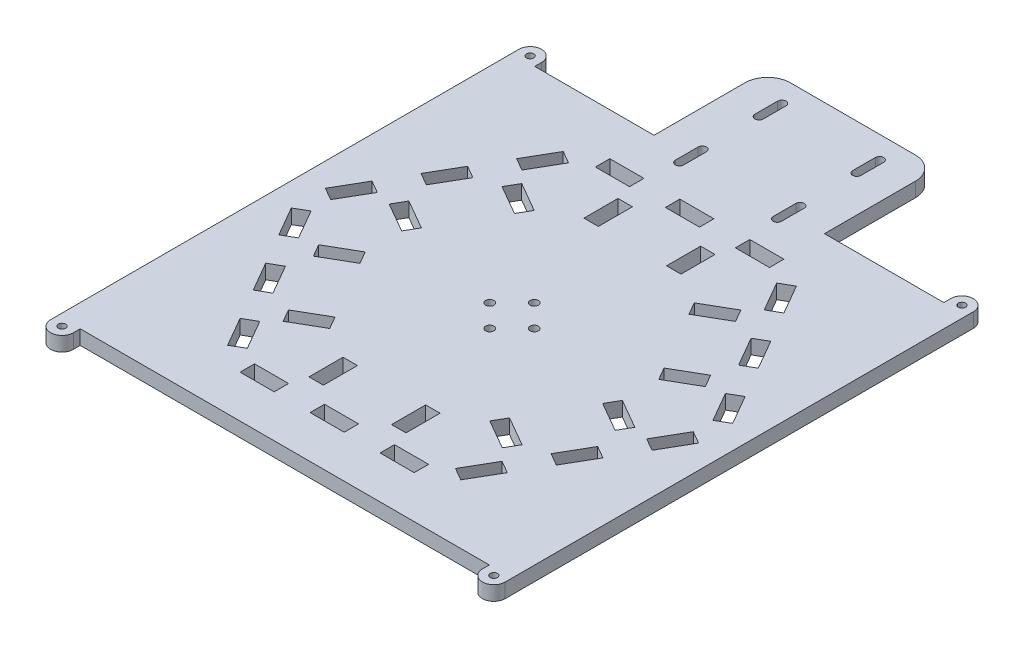
from build123d import *

# Parameters (mm, degrees)
ESQUISSE1_W                     = 200
ESQUISSE1_H                     = 200
BOSS_EXTRU_1_DEPTH              = 6.35
BOSS_EXTRU_2_DEPTH              = 6.35
ENL_V_MAT_EXTRU_1_REACH         = 149.324
ESQUISSE3_R                     = 1.5875
R_P_TITION_LIN_AIRE1_COUNT      = 2
R_P_TITION_LIN_AIRE1_PITCH      = 190
SYM_TRIE1_COPY_1_DEPTH          = 6.35
SYM_TRIE1_COPY_2_REACH          = 149.324
SYM_TRIE1_COPY_2_SKETCH_R       = 1.5875
ESQUISSE4_W                     = 75
ESQUISSE4_H                     = 50
BOSS_EXTRU_3_DEPTH              = 6.35
CONG_1_R                        = 10
SKETCH1_R                       = 1.8288
CUT_EXTRUDE1_DEPTH              = 6.35
CIRPATTERN1_COUNT               = 4
ESQUISSE7_W                     = 15
ESQUISSE7_H                     = 6.35
ENL_V_MAT_EXTRU_2_DEPTH         = 6.35
R_P_TITION_CIRCULAIRE1_COUNT    = 6
ENL_V_MAT_EXTRU_3_REACH         = 182.389
R_P_TITION_LIN_AIRE2_COUNT      = 2
R_P_TITION_LIN_AIRE2_PITCH      = 35
R_P_TITION_LIN_AIRE2_COUNT_DIR2 = 2
R_P_TITION_LIN_AIRE2_PITCH_DIR2 = 43
ENL_V_MAT_EXTRU_4_REACH         = 182.389
ESQUISSE9_W                     = 6.35
ESQUISSE9_H                     = 15
R_P_TITION_CIRCULAIRE2_COUNT    = 6


with BuildPart() as part:
    # Esquisse1 → Boss.-Extru.1 (new body)
    with BuildSketch(Plane(origin=(0, 0, 0), x_dir=(1, 0, 0), z_dir=(0, 1, 0))):
        Rectangle(ESQUISSE1_W, ESQUISSE1_H)
    extrude(amount=BOSS_EXTRU_1_DEPTH)

    # Esquisse2 → Boss.-Extru.2 (add)
    with BuildSketch(Plane(origin=(0, 6.35, 0), x_dir=(1, 0, 0), z_dir=(0, 1, 0))):
        with BuildLine():
            Line((-100, 100), (-90, 100))
            Line((-90, 100), (-90, 103))
            ThreePointArc((-90, 103), (-95, 108), (-100, 103))
            Line((-100, 103), (-100, 100))
        make_face()
    boss_extru_2 = extrude(amount=-BOSS_EXTRU_2_DEPTH)

    # Esquisse3 → Enlèv. mat.-Extru.1 (cut, up to next)
    with BuildSketch(Plane(origin=(0, 6.35, 0), x_dir=(1, 0, 0), z_dir=(0, 1, 0)), mode=Mode.PRIVATE) as enl_v_mat_extru_1_sk1:
        with Locations(Location((-95, 103, 0), (0, 0, 270))):
            Circle(ESQUISSE3_R)
    enl_v_mat_extru_1_tool1 = extrude(enl_v_mat_extru_1_sk1.sketch, amount=-ENL_V_MAT_EXTRU_1_REACH, mode=Mode.PRIVATE) & part.part
    enl_v_mat_extru_1 = enl_v_mat_extru_1_tool1.solids().sort_by_distance((-95, 6.35, -103))[0]
    add(enl_v_mat_extru_1, mode=Mode.SUBTRACT)

    # Répétition linéaire1: Boss.-Extru.2, Enlèv. mat.-Extru.1 ×2
    with Locations(*[(i * R_P_TITION_LIN_AIRE1_PITCH, 0, 0) for i in range(1, R_P_TITION_LIN_AIRE1_COUNT)]):
        add(boss_extru_2)
        add(enl_v_mat_extru_1, mode=Mode.SUBTRACT)

    # Symétrie1: Boss.-Extru.2, Enlèv. mat.-Extru.1 across plane
    add(boss_extru_2.mirror(Plane.XY))
    add(enl_v_mat_extru_1.mirror(Plane.XY), mode=Mode.SUBTRACT)

    # Symétrie1 copy 1 sketch → Symétrie1 copy 1 (add)
    with BuildSketch(Plane(origin=(190, 6.35, 0), x_dir=(1, 0, 0), z_dir=(0, 1, 0))):
        with BuildLine():
            Line((-100, -100), (-90, -100))
            Line((-90, -100), (-90, -103))
            ThreePointArc((-90, -103), (-95, -108), (-100, -103))
            Line((-100, -103), (-100, -100))
        make_face()
    extrude(amount=-SYM_TRIE1_COPY_1_DEPTH)

    # Symétrie1 copy 2 sketch → Symétrie1 copy 2 (cut, up to next)
    with BuildSketch(Plane(origin=(190, 6.35, 0), x_dir=(1, 0, 0), z_dir=(0, 1, 0)), mode=Mode.PRIVATE) as sym_trie1_copy_2_sk1:
        with Locations((-95, -103)):
            Circle(SYM_TRIE1_COPY_2_SKETCH_R)
    sym_trie1_copy_2_tool1 = extrude(sym_trie1_copy_2_sk1.sketch, amount=-SYM_TRIE1_COPY_2_REACH, mode=Mode.PRIVATE) & part.part
    add(sym_trie1_copy_2_tool1.solids().sort_by_distance((95, 6.35, 103))[0], mode=Mode.SUBTRACT)

    # Esquisse4 → Boss.-Extru.3 (add)
    with BuildSketch(Plane(origin=(0, 6.35, 0), x_dir=(1, 0, 0), z_dir=(0, 1, 0))):
        with Locations((0, 125)):
            Rectangle(ESQUISSE4_W, ESQUISSE4_H)
    extrude(amount=-BOSS_EXTRU_3_DEPTH)

    # Congé1
    cong_1_edges = [part.edges().sort_by_distance(p)[0] for p in [
        (-37.5, 3.175, -150),
        (37.5, 3.175, -150),
    ]]
    fillet(cong_1_edges, radius=CONG_1_R)

    # Sketch1 → Cut-Extrude1 (cut)
    with BuildSketch(Plane.XZ):
        with Locations(Location((0, -9.779, 0), (0, 0, 270))):
            Circle(SKETCH1_R)
    cut_extrude1 = extrude(amount=-CUT_EXTRUDE1_DEPTH, mode=Mode.SUBTRACT)

    # CirPattern1: Cut-Extrude1 ×4 about axis
    cirpattern1_axis = Axis((0, 0, 0), (0, 1, 0))
    for i in range(1, CIRPATTERN1_COUNT):
        add(cut_extrude1.rotate(cirpattern1_axis, i * 360 / CIRPATTERN1_COUNT), mode=Mode.SUBTRACT)

    # Esquisse7 → Enlèv. mat.-Extru.2 (cut)
    with BuildSketch(Plane.XZ):
        with Locations((30.801270189, -78.175)):
            Rectangle(ESQUISSE7_W, ESQUISSE7_H)
        with Locations((0, -78.175)):
            Rectangle(ESQUISSE7_W, ESQUISSE7_H)
        with Locations((-30.801270189, -78.175)):
            Rectangle(ESQUISSE7_W, ESQUISSE7_H)
    enl_v_mat_extru_2 = extrude(amount=-ENL_V_MAT_EXTRU_2_DEPTH, mode=Mode.SUBTRACT)

    # Répétition circulaire1: Enlèv. mat.-Extru.2 ×6 about axis
    r_p_tition_circulaire1_axis = Axis((0, 0, 0), (0, 1, 0))
    for i in range(1, R_P_TITION_CIRCULAIRE1_COUNT):
        add(enl_v_mat_extru_2.rotate(r_p_tition_circulaire1_axis, i * 360 / R_P_TITION_CIRCULAIRE1_COUNT), mode=Mode.SUBTRACT)

    # Esquisse8 → Enlèv. mat.-Extru.3 (cut, up to next)
    with BuildSketch(Plane(origin=(0, 6.35, 0), x_dir=(1, 0, 0), z_dir=(0, 1, 0)), mode=Mode.PRIVATE) as enl_v_mat_extru_3_sk1:
        with BuildLine():
            Line((-19.666666667, 140.227252842), (-19.666666667, 130.227252842))
            ThreePointArc((-19.666666667, 130.227252842), (-21.5, 128.393919509), (-23.333333333, 130.227252842))
            Line((-23.333333333, 130.227252842), (-23.333333333, 140.227252842))
            ThreePointArc((-23.333333333, 140.227252842), (-21.5, 142.060586175), (-19.666666667, 140.227252842))
        make_face()
    enl_v_mat_extru_3_tool1 = extrude(enl_v_mat_extru_3_sk1.sketch, amount=-ENL_V_MAT_EXTRU_3_REACH, mode=Mode.PRIVATE) & part.part
    enl_v_mat_extru_3 = enl_v_mat_extru_3_tool1.solids().sort_by_distance((-21.5, 6.35, -135.227253))[0]
    add(enl_v_mat_extru_3, mode=Mode.SUBTRACT)

    # Répétition linéaire2: Enl_v. mat.-Extru.3 2 × 2
    with Locations(*[(j * R_P_TITION_LIN_AIRE2_PITCH_DIR2, 0, i * R_P_TITION_LIN_AIRE2_PITCH) for i in range(R_P_TITION_LIN_AIRE2_COUNT) for j in range(R_P_TITION_LIN_AIRE2_COUNT_DIR2) if (i, j) != (0, 0)]):
        add(enl_v_mat_extru_3, mode=Mode.SUBTRACT)

    # Esquisse9 → Enlèv. mat.-Extru.4 (cut, up to next)
    with BuildSketch(Plane.XZ, mode=Mode.PRIVATE) as enl_v_mat_extru_4_sk1:
        with Locations((-18.175, -60.5)):
            Rectangle(ESQUISSE9_W, ESQUISSE9_H)
    enl_v_mat_extru_4_tool1 = extrude(enl_v_mat_extru_4_sk1.sketch, amount=-ENL_V_MAT_EXTRU_4_REACH, mode=Mode.PRIVATE) & part.part
    # Esquisse9 → Enlèv. mat.-Extru.4 (cut, up to next)
    with BuildSketch(Plane.XZ, mode=Mode.PRIVATE) as enl_v_mat_extru_4_sk2:
        with Locations((18.175, -60.5)):
            Rectangle(ESQUISSE9_W, ESQUISSE9_H)
    enl_v_mat_extru_4_tool2 = extrude(enl_v_mat_extru_4_sk2.sketch, amount=-ENL_V_MAT_EXTRU_4_REACH, mode=Mode.PRIVATE) & part.part
    enl_v_mat_extru_4_1 = enl_v_mat_extru_4_tool1.solids().sort_by_distance((-18.175, 0, -60.5))[0]
    add(enl_v_mat_extru_4_1, mode=Mode.SUBTRACT)
    enl_v_mat_extru_4_2 = enl_v_mat_extru_4_tool2.solids().sort_by_distance((18.175, 0, -60.5))[0]
    add(enl_v_mat_extru_4_2, mode=Mode.SUBTRACT)
    enl_v_mat_extru_4 = enl_v_mat_extru_4_1 + enl_v_mat_extru_4_2  # Enlèv. mat.-Extru.4 as one shape, for the pattern or mirror that repeats it

    # Répétition circulaire2: Enlèv. mat.-Extru.4 ×6 about axis
    r_p_tition_circulaire2_axis = Axis((0, 0, 0), (0, 1, 0))
    for i in range(1, R_P_TITION_CIRCULAIRE2_COUNT):
        add(enl_v_mat_extru_4.rotate(r_p_tition_circulaire2_axis, i * 360 / R_P_TITION_CIRCULAIRE2_COUNT), mode=Mode.SUBTRACT)


solid = part.part
